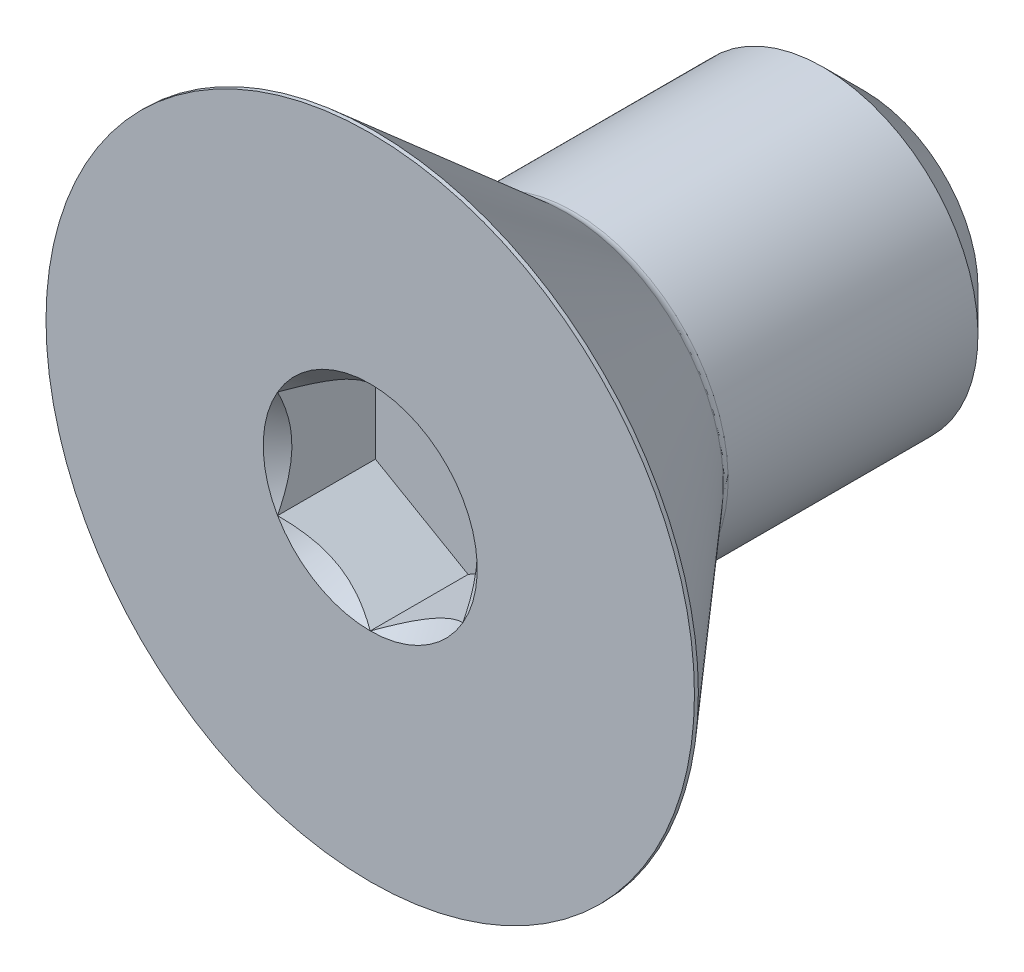
from build123d import *

# Parameters (mm, degrees)
SKETCH10_R         = 2.749630657
CUT_EXTRUDE2_DEPTH = 2.5146
CUT_EXTRUDE2_DRAFT = -45
CUT_EXTRUDE1_DEPTH = 2.5146


with BuildPart() as part:
    # Sketch2 → Revolve1 (revolve)
    with BuildSketch(Plane(origin=(0, 0, 0), x_dir=(0, 0, -1), z_dir=(1, 0, 0))):
        with BuildLine():
            Line((-6.249416, 8.3312), (-1.3208, 4.046819475))
            ThreePointArc((-1.3208, 4.046819475), (-1.231373272, 3.993616163), (-1.12897755, 3.9751))
            Line((-1.12897755, 3.9751), (5.291666667, 3.9751))
            Line((5.291666667, 3.9751), (6.35, 2.916766667))
            Line((6.35, 2.916766667), (6.35, 0))
            Line((6.35, 0), (-6.35, 0))
            Line((-6.35, 0), (-6.35, 8.3312))
            Line((-6.35, 8.3312), (-6.249416, 8.3312))
        make_face()
    revolve(axis=Axis((0, 0, -6.35), (0, 0, 1)))


with BuildPart() as cut_extrude2_tool:
    # Sketch10 → Cut-Extrude2 (with draft: the straight prism first)
    with BuildSketch(Plane.XY.offset(6.35)):
        Circle(SKETCH10_R)
    extrude(amount=-CUT_EXTRUDE2_DEPTH)
    # Cut-Extrude2: the draft: its side faces are tilted about the plane it starts from
    cut_extrude2_sides = [cut_extrude2_tool.faces().sort_by_distance(p)[0] for p in [
        (-2.749630657, 0, 5.0927),
    ]]
    draft(cut_extrude2_sides, Plane.XY.offset(6.35), CUT_EXTRUDE2_DRAFT)


with BuildPart() as part_1:
    add(part.part)

    # Cut-Extrude2: cut by cut_extrude2_tool
    add(cut_extrude2_tool.part, mode=Mode.SUBTRACT)

    # Sketch9 → Cut-Extrude1 (cut)
    with BuildSketch(Plane.XY.offset(6.35)):
        Polygon((2.38125, -1.374815329), (2.38125, 1.374815329), (0, 2.749630657), (-2.38125, 1.374815329), (-2.38125, -1.374815329), (0, -2.749630657), align=None)
    extrude(amount=-CUT_EXTRUDE1_DEPTH, mode=Mode.SUBTRACT)


solid = part_1.part
